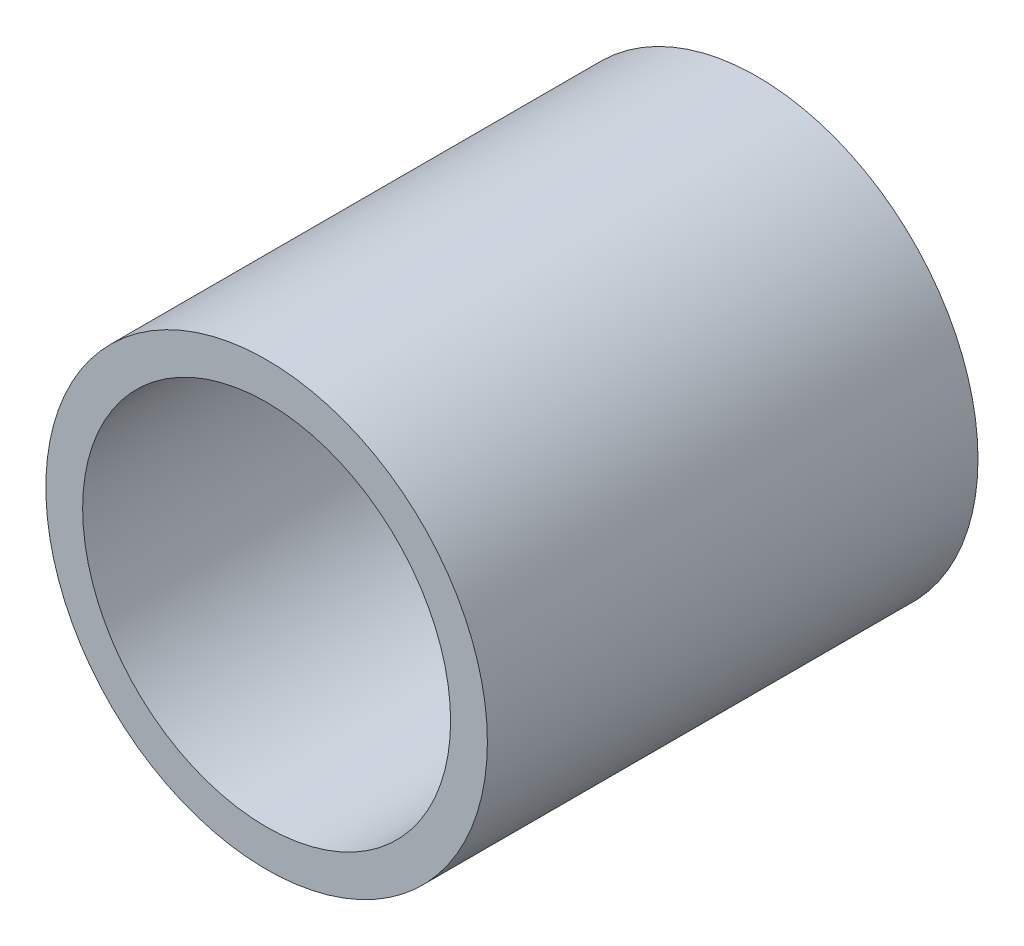
from build123d import *

# Parameters (mm, degrees)
SKETCH1_R           = 54
SKETCH1_R_2         = 45
BOSS_EXTRUDE1_DEPTH = 120


with BuildPart() as part:
    # Sketch1 → Boss-Extrude1 (new body)
    with BuildSketch(Plane.XY):
        Circle(SKETCH1_R)
        Circle(SKETCH1_R_2, mode=Mode.SUBTRACT)
    extrude(amount=BOSS_EXTRUDE1_DEPTH)


solid = part.part
